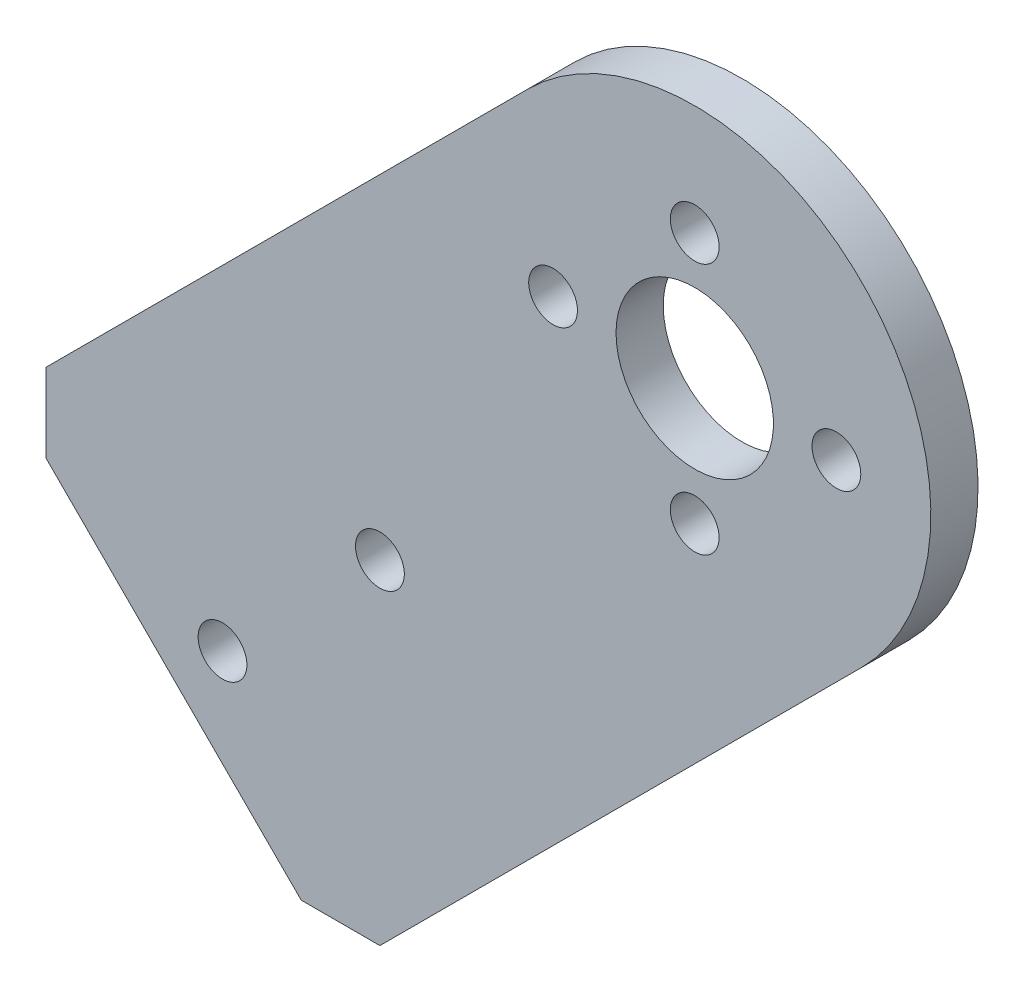
from build123d import *

# Parameters (mm, degrees)
SKETCH_1_W          = 140
SKETCH_1_H          = 140
SKETCH_1_R          = 1.55
EXTRUDE_1_DEPTH     = 3
SKETCH_2_R          = 1.55
SKETCH_2_W          = 3
SKETCH_2_H          = 25
CUT_EXTRUDE_1_DEPTH = 100.040395799
SKETCH_3_R          = 5
SKETCH_3_R_2        = 1.55
EXTRUDE_2_DEPTH     = 3
CUT_EXTRUDE_START   = -10
SKETCH_4_R          = 1.55
CUT_EXTRUDE_2_DEPTH = 10


with BuildPart() as part:
    # 草圖1 → 填料-伸長1 (new body)
    with BuildSketch(Plane.XY):
        Rectangle(SKETCH_1_W, SKETCH_1_H)
        with Locations((-60, 60)):
            Circle(SKETCH_1_R, mode=Mode.SUBTRACT)
        with Locations((60, 60)):
            Circle(SKETCH_1_R, mode=Mode.SUBTRACT)
        with Locations((60, -60)):
            Circle(SKETCH_1_R, mode=Mode.SUBTRACT)
        with Locations((-60, -60)):
            Circle(SKETCH_1_R, mode=Mode.SUBTRACT)
    extrude(amount=EXTRUDE_1_DEPTH)

    # 草圖2 → 除料-伸長1 (cut, through all)
    with BuildSketch(Plane.XY.offset(3)):
        with Locations((-12.25, 62.5)):
            Circle(SKETCH_2_R)
        with Locations((12.25, 62.5)):
            Circle(SKETCH_2_R)
        with Locations((-12.25, 7.5)):
            Circle(SKETCH_2_R)
        with Locations((12.25, 7.5)):
            Circle(SKETCH_2_R)
        with Locations((-60, -30)):
            Rectangle(SKETCH_2_W, SKETCH_2_H)
        with Locations((-60, 30)):
            Rectangle(SKETCH_2_W, SKETCH_2_H)
        with Locations((-20, -30)):
            Rectangle(SKETCH_2_W, SKETCH_2_H)
        with Locations((-20, 30)):
            Rectangle(SKETCH_2_W, SKETCH_2_H)
        with Locations((20, 30)):
            Rectangle(SKETCH_2_W, SKETCH_2_H)
        with Locations((20, -30)):
            Rectangle(SKETCH_2_W, SKETCH_2_H)
        with Locations((60, -30)):
            Rectangle(SKETCH_2_W, SKETCH_2_H)
        with Locations((60, 30)):
            Rectangle(SKETCH_2_W, SKETCH_2_H)
    extrude(amount=-CUT_EXTRUDE_1_DEPTH, mode=Mode.SUBTRACT)

    # 草圖3 → 填料-伸長2 (add)
    # profile 1 of 4: a face of its own
    with BuildSketch(Plane.XY.offset(3)):
        with BuildLine():
            Line((-79.393398282, 100.606601718), (-48.786796564, 70))
            Line((-48.786796564, 70), (-70, 70))
            Line((-70, 70), (-70, 48.786796564))
            Line((-70, 48.786796564), (-100.606601718, 79.393398282))
            ThreePointArc((-100.606601718, 79.393398282), (-100.606601718, 100.606601718), (-79.393398282, 100.606601718))
        make_face()
        with Locations((-90, 90)):
            Circle(SKETCH_3_R, mode=Mode.SUBTRACT)
        with Locations((-81, 90)):
            Circle(SKETCH_3_R_2, mode=Mode.SUBTRACT)
        with Locations((-90, 98)):
            Circle(SKETCH_3_R_2, mode=Mode.SUBTRACT)
        with Locations(Location((-99, 90, 0), (0, 0, 180))):
            Circle(SKETCH_3_R_2, mode=Mode.SUBTRACT)
        with Locations(Location((-90, 82, 0), (0, 0, 180))):
            Circle(SKETCH_3_R_2, mode=Mode.SUBTRACT)
    # profile 2 of 4: a face of its own
    with BuildSketch(Plane.XY.offset(3)):
        with BuildLine():
            Line((48.786796564, 70), (70, 70))
            Line((70, 70), (70, 48.786796564))
            Line((70, 48.786796564), (100.606601718, 79.393398282))
            ThreePointArc((100.606601718, 79.393398282), (100.606601718, 100.606601718), (79.393398282, 100.606601718))
            Line((79.393398282, 100.606601718), (48.786796564, 70))
        make_face()
        with Locations(Location((81, 90, 0), (0, 0, 180))):
            Circle(SKETCH_3_R_2, mode=Mode.SUBTRACT)
        with Locations(Location((90, 90, 0), (0, 0, 180))):
            Circle(SKETCH_3_R, mode=Mode.SUBTRACT)
        with Locations((90, 82)):
            Circle(SKETCH_3_R_2, mode=Mode.SUBTRACT)
        with Locations(Location((90, 98, 0), (0, 0, 180))):
            Circle(SKETCH_3_R_2, mode=Mode.SUBTRACT)
        with Locations((99, 90)):
            Circle(SKETCH_3_R_2, mode=Mode.SUBTRACT)
    # profile 3 of 4: a face of its own
    with BuildSketch(Plane.XY.offset(3)):
        with BuildLine():
            Line((-48.786796564, -70), (-70, -70))
            Line((-70, -70), (-70, -48.786796564))
            Line((-70, -48.786796564), (-100.606601718, -79.393398282))
            ThreePointArc((-100.606601718, -79.393398282), (-100.606601718, -100.606601718), (-79.393398282, -100.606601718))
            Line((-79.393398282, -100.606601718), (-48.786796564, -70))
        make_face()
        with Locations((-90, -82)):
            Circle(SKETCH_3_R_2, mode=Mode.SUBTRACT)
        with Locations(Location((-90, -90, 0), (0, 0, 180))):
            Circle(SKETCH_3_R, mode=Mode.SUBTRACT)
        with Locations(Location((-81, -90, 0), (0, 0, 180))):
            Circle(SKETCH_3_R_2, mode=Mode.SUBTRACT)
        with Locations(Location((-90, -98, 0), (0, 0, 180))):
            Circle(SKETCH_3_R_2, mode=Mode.SUBTRACT)
        with Locations((-99, -90)):
            Circle(SKETCH_3_R_2, mode=Mode.SUBTRACT)
    # profile 4 of 4: a face of its own
    with BuildSketch(Plane.XY.offset(3)):
        with BuildLine():
            Line((79.393398282, -100.606601718), (48.786796564, -70))
            Line((48.786796564, -70), (70, -70))
            Line((70, -70), (70, -48.786796564))
            Line((70, -48.786796564), (100.606601718, -79.393398282))
            ThreePointArc((100.606601718, -79.393398282), (100.606601718, -100.606601718), (79.393398282, -100.606601718))
        make_face()
        with Locations(Location((90, -82, 0), (0, 0, 180))):
            Circle(SKETCH_3_R_2, mode=Mode.SUBTRACT)
        with Locations((90, -90)):
            Circle(SKETCH_3_R, mode=Mode.SUBTRACT)
        with Locations((81, -90)):
            Circle(SKETCH_3_R_2, mode=Mode.SUBTRACT)
        with Locations((90, -98)):
            Circle(SKETCH_3_R_2, mode=Mode.SUBTRACT)
        with Locations(Location((99, -90, 0), (0, 0, 180))):
            Circle(SKETCH_3_R_2, mode=Mode.SUBTRACT)
    extrude(amount=-EXTRUDE_2_DEPTH)

    # 草圖4 → 除料-伸長2 (cut)
    with BuildSketch(Plane(origin=(0, 0, 0), x_dir=(-1, 0, 0), z_dir=(0, 0, -1)).offset(CUT_EXTRUDE_START)):
        with Locations((-70, 70)):
            Circle(SKETCH_4_R)
        with BuildLine():
            Line((-70, 48.786796564), (-65, 48.786796564))
            Line((-65, 48.786796564), (-48.786796564, 65))
            Line((-48.786796564, 65), (-48.786796564, 70))
            Line((-48.786796564, 70), (48.786796564, 70))
            Line((48.786796564, 70), (79.393398282, 100.606601718))
            ThreePointArc((79.393398282, 100.606601718), (100.606601718, 100.606601718), (100.606601718, 79.393398282))
            Line((100.606601718, 79.393398282), (70, 48.786796564))
            Line((70, 48.786796564), (70, -48.786796564))
            Line((70, -48.786796564), (100.606601718, -79.393398282))
            ThreePointArc((100.606601718, -79.393398282), (100.606601718, -100.606601718), (79.393398282, -100.606601718))
            Line((79.393398282, -100.606601718), (48.786796564, -70))
            Line((48.786796564, -70), (-48.786796564, -70))
            Line((-48.786796564, -70), (-79.393398282, -100.606601718))
            ThreePointArc((-79.393398282, -100.606601718), (-100.606601718, -100.606601718), (-100.606601718, -79.393398282))
            Line((-100.606601718, -79.393398282), (-70, -48.786796564))
            Line((-70, -48.786796564), (-70, 48.786796564))
        make_face()
    extrude(amount=CUT_EXTRUDE_2_DEPTH, mode=Mode.SUBTRACT)


solid = part.part
